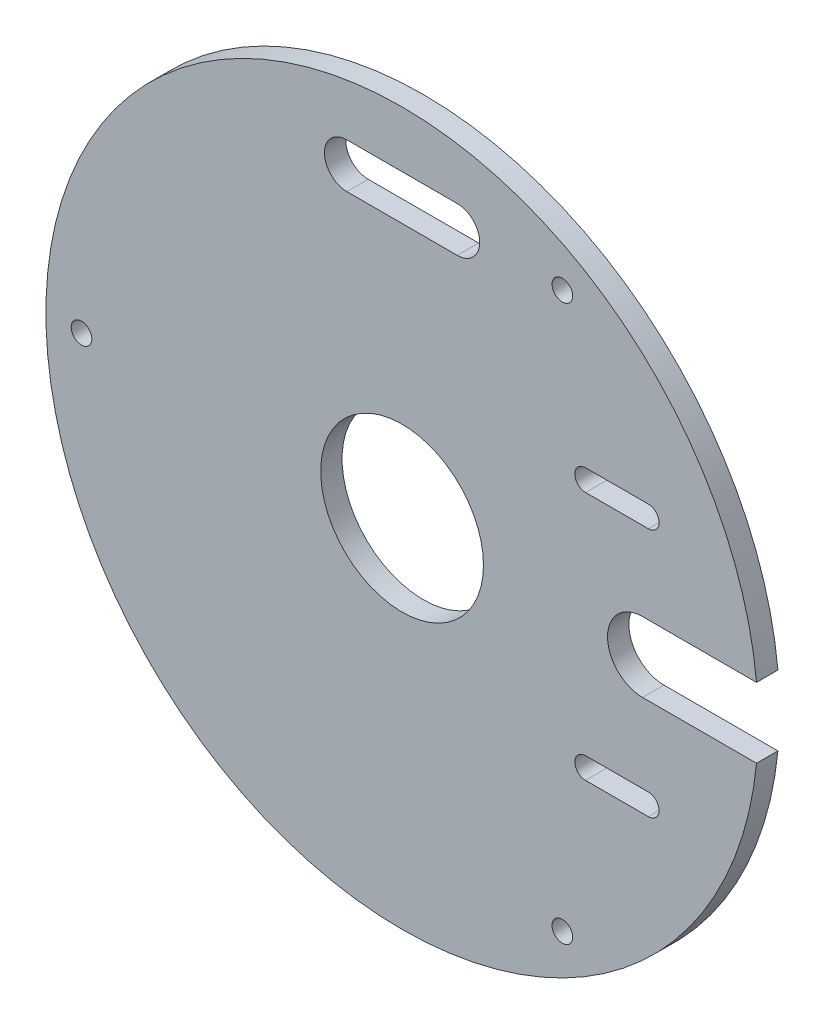
from build123d import *

# Parameters (mm, degrees)
SKETCH1_R           = 50
SKETCH1_R_2         = 1.45
SKETCH1_R_3         = 11.425
BOSS_EXTRUDE1_DEPTH = 3
CUT_EXTRUDE4_REACH  = 72.774
CUT_EXTRUDE3_DEPTH  = 10


with BuildPart() as part:
    # Sketch1 → Boss-Extrude1 (new body)
    with BuildSketch(Plane.XY):
        Circle(SKETCH1_R)
        with Locations((22.5, -38.97114317)):
            Circle(SKETCH1_R_2, mode=Mode.SUBTRACT)
        with Locations((-45, 0)):
            Circle(SKETCH1_R_2, mode=Mode.SUBTRACT)
        Circle(SKETCH1_R_3, mode=Mode.SUBTRACT)
        with Locations((22.5, 38.97114317)):
            Circle(SKETCH1_R_2, mode=Mode.SUBTRACT)
    extrude(amount=BOSS_EXTRUDE1_DEPTH)

    # Sketch1_6 → Cut-Extrude4 (cut, up to next)
    with BuildSketch(Plane.XY, mode=Mode.PRIVATE) as cut_extrude4_sk1:
        with BuildLine():
            Line((7.75, 42.119988573), (-7.75, 42.119988573))
            ThreePointArc((-7.75, 42.119988573), (-10.898845402, 38.97114317), (-7.75, 35.822297768))
            Line((-7.75, 35.822297768), (7.75, 35.822297768))
            ThreePointArc((7.75, 35.822297768), (10.898845402, 38.97114317), (7.75, 42.119988573))
        make_face()
    cut_extrude4_tool1 = extrude(cut_extrude4_sk1.sketch, amount=CUT_EXTRUDE4_REACH, mode=Mode.PRIVATE) & part.part
    add(cut_extrude4_tool1.solids().sort_by_distance((0, 38.971143, 0))[0], mode=Mode.SUBTRACT)

    # Sketch2 → Cut-Extrude3 (cut)
    with BuildSketch(Plane(origin=(0, 0, 0), x_dir=(-1, 0, 0), z_dir=(0, 0, -1))):
        with BuildLine():
            Line((-50.492676186, 4.91367638), (-33.753889757, 4.91367638))
            ThreePointArc((-33.753889757, 4.91367638), (-28.840213376, 0), (-33.753889757, -4.91367638))
            Line((-33.753889757, -4.91367638), (-50.492676186, -4.91367638))
            ThreePointArc((-50.492676186, -4.91367638), (-55.406352566, 0), (-50.492676186, 4.91367638))
        make_face()
        with BuildLine():
            Line((-34.573554166, 19), (-25.753889757, 19))
            ThreePointArc((-25.753889757, 19), (-24.253889757, 17.5), (-25.753889757, 16))
            Line((-25.753889757, 16), (-34.573554166, 16))
            ThreePointArc((-34.573554166, 16), (-36.073554166, 17.5), (-34.573554166, 19))
        make_face()
        with BuildLine():
            Line((-34.573554166, -19), (-25.753889757, -19))
            ThreePointArc((-25.753889757, -19), (-24.253889757, -17.5), (-25.753889757, -16))
            Line((-25.753889757, -16), (-34.573554166, -16))
            ThreePointArc((-34.573554166, -16), (-36.073554166, -17.5), (-34.573554166, -19))
        make_face()
    extrude(amount=-CUT_EXTRUDE3_DEPTH, mode=Mode.SUBTRACT)


solid = part.part
